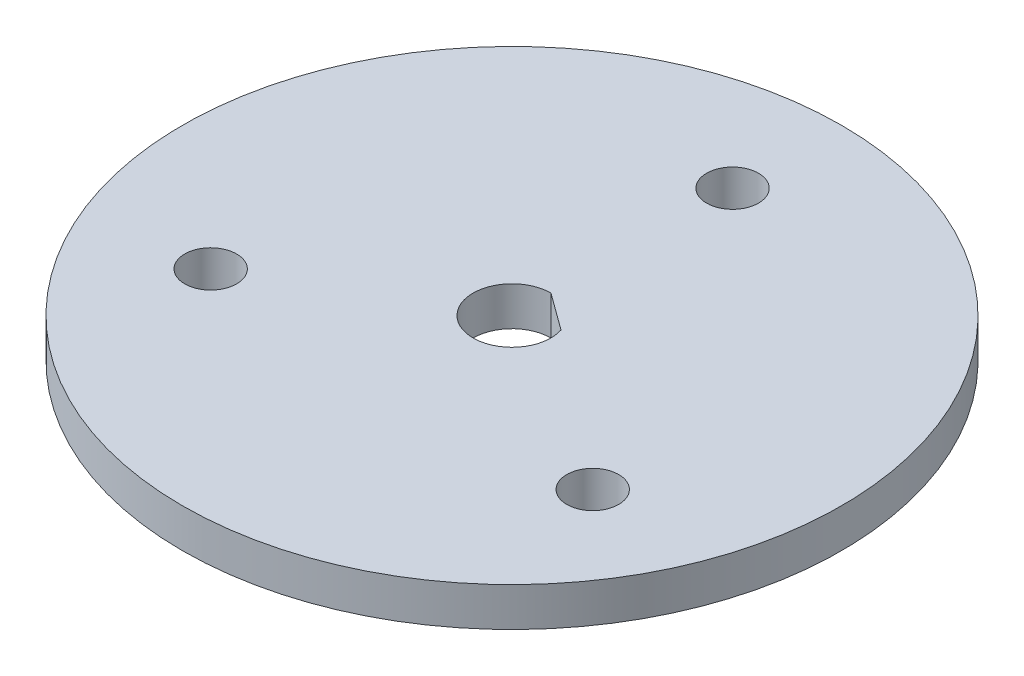
from build123d import *

# Parameters (mm, degrees)
SKETCH1_R           = 25.4
BOSS_EXTRUDE1_DEPTH = 3
CUT_EXTRUDE1_DEPTH  = 5
SKETCH3_R           = 2
CUT_EXTRUDE2_DEPTH  = 5


with BuildPart() as part:
    # Sketch1 → Boss-Extrude1 (new body)
    with BuildSketch(Plane(origin=(0, 0, 0), x_dir=(1, 0, 0), z_dir=(0, 1, 0))):
        with Locations(Location((0, 0, 0), (0, 0, 270))):
            Circle(SKETCH1_R)
    extrude(amount=BOSS_EXTRUDE1_DEPTH)

    # Sketch2 → Cut-Extrude1 (cut)
    with BuildSketch(Plane(origin=(0, 3, 0), x_dir=(1, 0, 0), z_dir=(0, 1, 0))):
        with BuildLine():
            Line((2.854423328, 0.923183333), (0, 3))
            ThreePointArc((0, 3), (-2.121320344, -2.121320344), (3, 0))
            ThreePointArc((3, 0), (2.963382357, 0.467295419), (2.854423328, 0.923183333))
        make_face()
    extrude(amount=-CUT_EXTRUDE1_DEPTH, mode=Mode.SUBTRACT)

    # Sketch3 → Cut-Extrude2 (cut)
    with BuildSketch(Plane(origin=(0, 3, 0), x_dir=(1, 0, 0), z_dir=(0, 1, 0))):
        with Locations(Location((0, 17, 0), (0, 0, 270))):
            Circle(SKETCH3_R)
        with Locations(Location((14.722431864, -8.5, 0), (0, 0, 270))):
            Circle(SKETCH3_R)
        with Locations(Location((-14.722431864, -8.5, 0), (0, 0, 270))):
            Circle(SKETCH3_R)
    extrude(amount=-CUT_EXTRUDE2_DEPTH, mode=Mode.SUBTRACT)


solid = part.part
